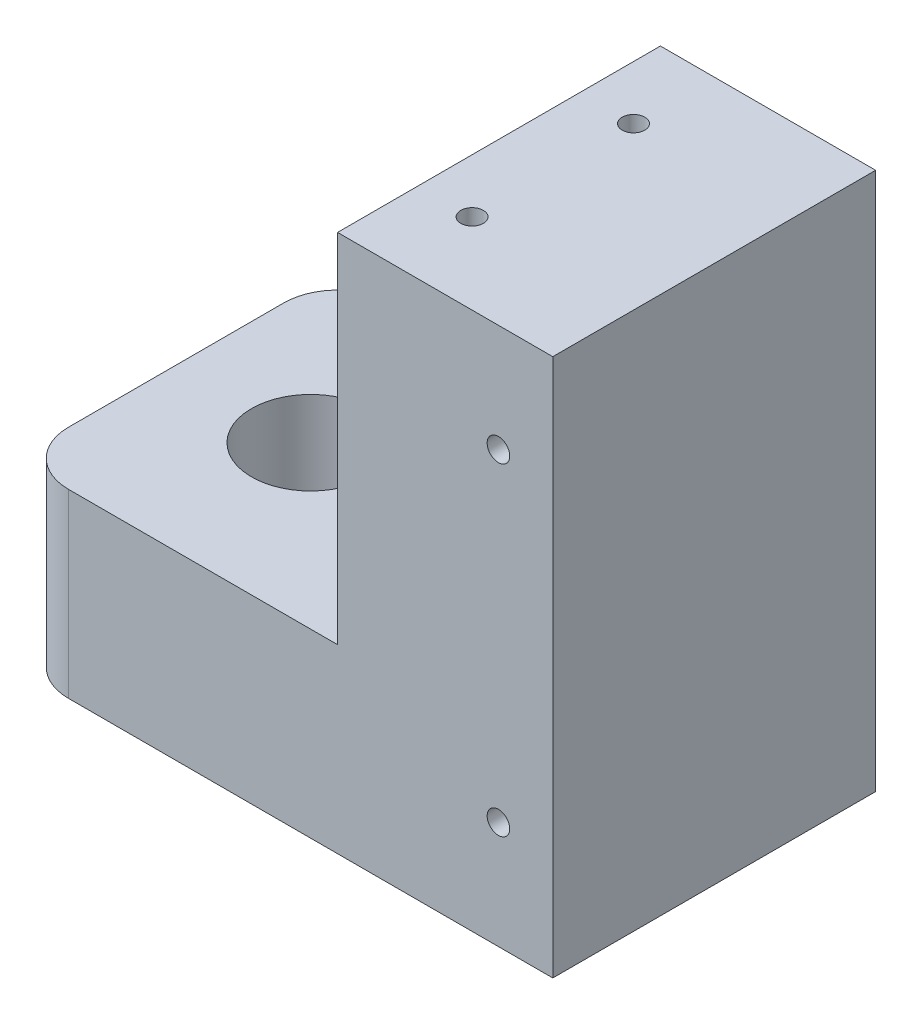
from build123d import *

# Parameters (mm, degrees)
SKETCH1_W                  = 100
SKETCH1_H                  = 100
BOSS_EXTRUDE1_DEPTH        = 100
SKETCH2_W                  = 60
SKETCH2_H                  = 100
CUT_EXTRUDE1_DEPTH         = 174.205080757
CUT_EXTRUDE2_DEPTH         = 157.212427483
CUT_EXTRUDE2_DEPTH_BACK    = 157.212427483
SKETCH3_R                  = 11
SKETCH4_W                  = 40
SKETCH4_H                  = 100
CUT_EXTRUDE3_DEPTH         = 174.205080757
BOSS_EXTRUDE2_START        = -10.65
SKETCH5_R                  = 11
SKETCH5_R_2                = 8
BOSS_EXTRUDE2_DEPTH        = 10.65
M5_TAPPED_HOLE1_AT_2_COUNT = 2
M5_TAPPED_HOLE1_AT_2_PITCH = 60
M5_TAPPED_HOLE2_D          = 4.2
M5_TAPPED_HOLE2_DEPTH      = 22
M5_TAPPED_HOLE2_TIP        = 1.2618073
M8_TAPPED_HOLE1_D          = 6.8
M8_TAPPED_HOLE1_DEPTH      = 24.25
M8_TAPPED_HOLE1_TIP        = 2.042926105
FILLET3_R                  = 10


with BuildPart() as part:
    # Sketch1 → Boss-Extrude1 (new body)
    with BuildSketch(Plane(origin=(0, 0, 0), x_dir=(1, 0, 0), z_dir=(0, 1, 0))):
        with Locations((50, 50)):
            Rectangle(SKETCH1_W, SKETCH1_H)
    extrude(amount=BOSS_EXTRUDE1_DEPTH)

    # Sketch2 → Cut-Extrude1 (cut, through all)
    with BuildSketch(Plane.XY):
        with Locations((30, 83.65)):
            Rectangle(SKETCH2_W, SKETCH2_H)
    extrude(amount=-CUT_EXTRUDE1_DEPTH, mode=Mode.SUBTRACT)

    # Sketch3 → Cut-Extrude2 (cut, two sides: drawn at the far end of the back side and taken through both)
    with BuildSketch(Plane(origin=(0, 33.65, 0), x_dir=(1, 0, 0), z_dir=(0, 1, 0)).offset(-CUT_EXTRUDE2_DEPTH_BACK)):
        with Locations((25, 30)):
            Circle(SKETCH3_R)
    extrude(amount=CUT_EXTRUDE2_DEPTH + CUT_EXTRUDE2_DEPTH_BACK, mode=Mode.SUBTRACT)

    # Sketch4 → Cut-Extrude3 (cut, through all)
    with BuildSketch(Plane.ZY):
        with Locations((-80, 50)):
            Rectangle(SKETCH4_W, SKETCH4_H)
    extrude(amount=-CUT_EXTRUDE3_DEPTH, mode=Mode.SUBTRACT)

    # Sketch5 → Boss-Extrude2 (add)
    with BuildSketch(Plane.XZ.offset(BOSS_EXTRUDE2_START)):
        with Locations((25, -30)):
            Circle(SKETCH5_R)
        with Locations((25, -30)):
            Circle(SKETCH5_R_2, mode=Mode.SUBTRACT)
    extrude(amount=BOSS_EXTRUDE2_DEPTH)

    # Sketch11 → M5 Tapped Hole1 (revolve, cut)
    with BuildSketch(Plane(origin=(89.9, 80, 0), x_dir=(0, -1, 0), z_dir=(1, 0, 0))):
        Polygon((0, 0), (0, 16.2618073), (2.1, 15), (2.1, 0), align=None)
    m5_tapped_hole1 = revolve(axis=Axis((89.9, 80, 6.35), (0, 0, -1)), mode=Mode.SUBTRACT)

    # M5 Tapped Hole1 at 2: M5 Tapped Hole1 ×2
    with Locations(*[(0, -i * M5_TAPPED_HOLE1_AT_2_PITCH, 0) for i in range(1, M5_TAPPED_HOLE1_AT_2_COUNT)]):
        add(m5_tapped_hole1, mode=Mode.SUBTRACT)

    # Mirror1: M5 Tapped Hole1 across plane
    add(m5_tapped_hole1.mirror(Plane.XY.offset(-30)), mode=Mode.SUBTRACT)

    # Mirror1 copy 1 sketch → Mirror1 copy 1 (revolve, cut)
    with BuildSketch(Plane(origin=(89.9, 20, -60), x_dir=(0, -1, 0), z_dir=(1, 0, 0))):
        Polygon((0, 0), (0, -16.2618073), (2.1, -15), (2.1, 0), align=None)
    revolve(axis=Axis((89.9, 20, -66.35), (0, 0, -1)), mode=Mode.SUBTRACT)

    # M5 Tapped Hole2
    with Locations(Plane(origin=(0, 100, 0), x_dir=(1, 0, 0), z_dir=(0, 1, 0))):
        with Locations((70, 45), (70, 15)):
            Hole(M5_TAPPED_HOLE2_D / 2, depth=M5_TAPPED_HOLE2_DEPTH)
            with Locations((0, 0, -(M5_TAPPED_HOLE2_DEPTH + M5_TAPPED_HOLE2_TIP / 2))):  # 118° drill point
                Cone(0, M5_TAPPED_HOLE2_D / 2, M5_TAPPED_HOLE2_TIP, mode=Mode.SUBTRACT)

    # M8 Tapped Hole1
    with Locations(Plane(origin=(0, 0, 0), x_dir=(-1, 0, 0), z_dir=(0, -1, 0))):
        with Locations((-70, 15), (-70, 45)):
            Hole(M8_TAPPED_HOLE1_D / 2, depth=M8_TAPPED_HOLE1_DEPTH)
            with Locations((0, 0, -(M8_TAPPED_HOLE1_DEPTH + M8_TAPPED_HOLE1_TIP / 2))):  # 118° drill point
                Cone(0, M8_TAPPED_HOLE1_D / 2, M8_TAPPED_HOLE1_TIP, mode=Mode.SUBTRACT)

    # Fillet3
    fillet3_edges = [part.edges().sort_by_distance(p)[0] for p in [
        (0, 16.825, 0),
        (0, 16.825, -60),
    ]]
    fillet(fillet3_edges, radius=FILLET3_R)


solid = part.part
